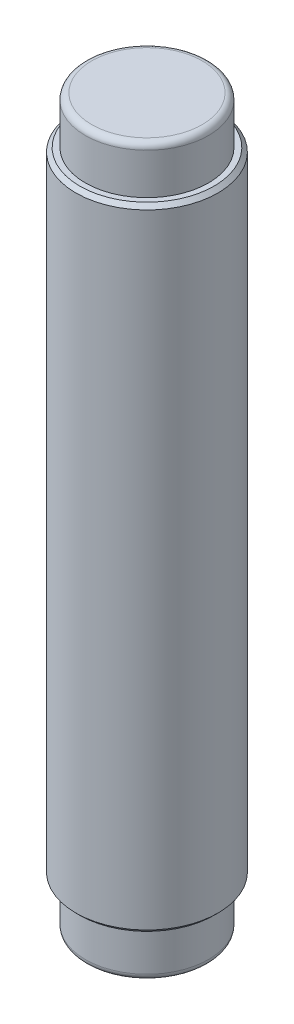
from build123d import *

# Parameters (mm, degrees)
SKETCH1_R           = 3.9
BOSS_EXTRUDE1_DEPTH = 46
FILLET5_R           = 0.4
SKETCH2_R           = 4.5
BOSS_EXTRUDE2_DEPTH = 20
CHAMFER1_SIZE       = 0.25


with BuildPart() as part:
    # Sketch1 → Boss-Extrude1 (new body)
    with BuildSketch(Plane(origin=(0, 0, 0), x_dir=(1, 0, 0), z_dir=(0, 1, 0))):
        with Locations(Location((0, 0, 0), (0, 0, 270))):
            Circle(SKETCH1_R)
    extrude(amount=BOSS_EXTRUDE1_DEPTH)

    # Fillet5
    fillet5_edges = [part.edges().sort_by_distance(p)[0] for p in [
        (0, 0, -3.9),
        (0, 46, -3.9),
    ]]
    fillet(fillet5_edges, radius=FILLET5_R)

    # Sketch2 → Boss-Extrude2 (add, symmetric)
    with BuildSketch(Plane(origin=(0, 23, 0), x_dir=(1, 0, 0), z_dir=(0, 1, 0))):
        with Locations(Location((0, 0, 0), (0, 0, 270))):
            Circle(SKETCH2_R)
    extrude(amount=BOSS_EXTRUDE2_DEPTH, both=True)

    # Chamfer1
    chamfer1_edges = [part.edges().sort_by_distance(p)[0] for p in [
        (0, 3, -4.5),
        (0, 43, -4.5),
    ]]
    chamfer(chamfer1_edges, length=CHAMFER1_SIZE)


solid = part.part
